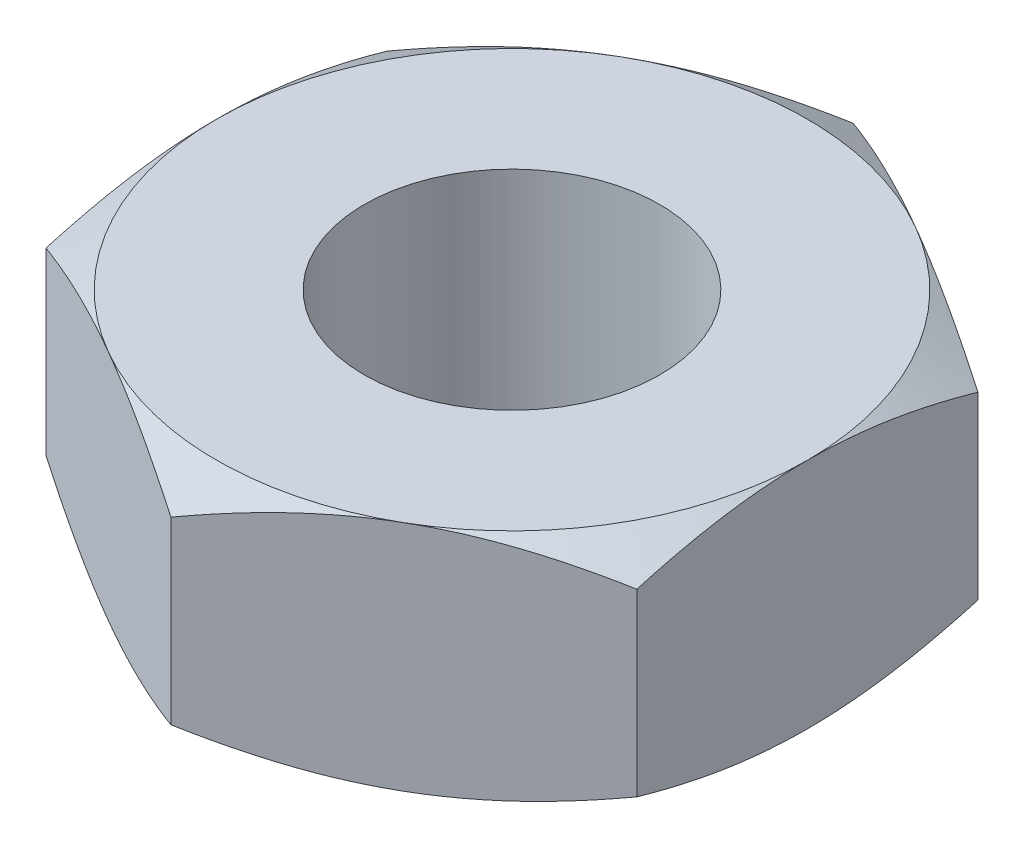
from build123d import *

# Parameters (mm, degrees)
BOSS_EXTRUDE1_DEPTH     = 5
SKETCH2_R               = 6.35
CUT_EXTRUDE1_DEPTH      = 22.82529114
SKETCH3_OUTSIDE_W       = 114.482
SKETCH3_OUTSIDE_H       = 118.412
SKETCH3_OUTSIDE_R       = 12.7
CUT_EXTRUDE2_DEPTH      = 22.82529114
CUT_EXTRUDE2_DRAFT      = -60
MIRROR1_COPY_1_SKETCH_W = 114.482
MIRROR1_COPY_1_SKETCH_H = 118.412
MIRROR1_COPY_1_SKETCH_R = 12.7
MIRROR1_COPY_1_DEPTH    = 22.82529114
MIRROR1_COPY_1_DRAFT    = -60


with BuildPart() as part:
    # Sketch1 → Boss-Extrude1 (new, symmetric)
    with BuildSketch(Plane(origin=(0, 0, 0), x_dir=(1, 0, 0), z_dir=(0, 1, 0))):
        Polygon((-12.7, 7.332348419), (-12.7, -7.332348419), (0, -14.664696837), (12.7, -7.332348419), (12.7, 7.332348419), (0, 14.664696837), align=None)
    extrude(amount=BOSS_EXTRUDE1_DEPTH, both=True)

    # Sketch2 → Cut-Extrude1 (cut, through all)
    with BuildSketch(Plane(origin=(0, 5, 0), x_dir=(1, 0, 0), z_dir=(0, 1, 0))):
        with Locations(Location((0, 0, 0), (0, 0, 270))):
            Circle(SKETCH2_R)
    extrude(amount=-CUT_EXTRUDE1_DEPTH, mode=Mode.SUBTRACT)


with BuildPart() as cut_extrude2_tool:
    # Sketch3 outside → Cut-Extrude2 (with draft: the straight prism first)
    with BuildSketch(Plane(origin=(0, 5, 0), x_dir=(1, 0, 0), z_dir=(0, 1, 0))):
        Rectangle(SKETCH3_OUTSIDE_W, SKETCH3_OUTSIDE_H)
        Circle(SKETCH3_OUTSIDE_R, mode=Mode.SUBTRACT)
    extrude(amount=-CUT_EXTRUDE2_DEPTH)
    # Cut-Extrude2: the draft: its side faces are tilted about the plane it starts from
    cut_extrude2_sides = [cut_extrude2_tool.faces().sort_by_distance(p)[0] for p in [
        (0, -6.41264557, 59.206),
        (57.241, -6.41264557, 0),
        (0, -6.41264557, -59.206),
        (-57.241, -6.41264557, 0),
        (-12.7, -6.41264557, 0),
    ]]
    draft(cut_extrude2_sides, Plane(origin=(0, 5, 0), x_dir=(1, 0, 0), z_dir=(0, 1, 0)), CUT_EXTRUDE2_DRAFT)


with BuildPart() as part_1:
    add(part.part)

    # Cut-Extrude2: cut by cut_extrude2_tool
    add(cut_extrude2_tool.part, mode=Mode.SUBTRACT)


with BuildPart() as mirror1_copy_1_tool:
    # Mirror1 copy 1 sketch → Mirror1 copy 1 (with draft: the straight prism first)
    with BuildSketch(Plane.XZ.offset(5)):
        Rectangle(MIRROR1_COPY_1_SKETCH_W, MIRROR1_COPY_1_SKETCH_H)
        Circle(MIRROR1_COPY_1_SKETCH_R, mode=Mode.SUBTRACT)
    extrude(amount=-MIRROR1_COPY_1_DEPTH)
    # Mirror1 copy 1: the draft: its side faces are tilted about the plane it starts from
    mirror1_copy_1_sides = [mirror1_copy_1_tool.faces().sort_by_distance(p)[0] for p in [
        (0, 6.41264557, 59.206),
        (57.241, 6.41264557, 0),
        (0, 6.41264557, -59.206),
        (-57.241, 6.41264557, 0),
        (-12.7, 6.41264557, 0),
    ]]
    draft(mirror1_copy_1_sides, Plane.XZ.offset(5), MIRROR1_COPY_1_DRAFT)


with BuildPart() as part_2:
    add(part_1.part)

    # Mirror1 copy 1: cut by mirror1_copy_1_tool
    add(mirror1_copy_1_tool.part, mode=Mode.SUBTRACT)


solid = part_2.part
